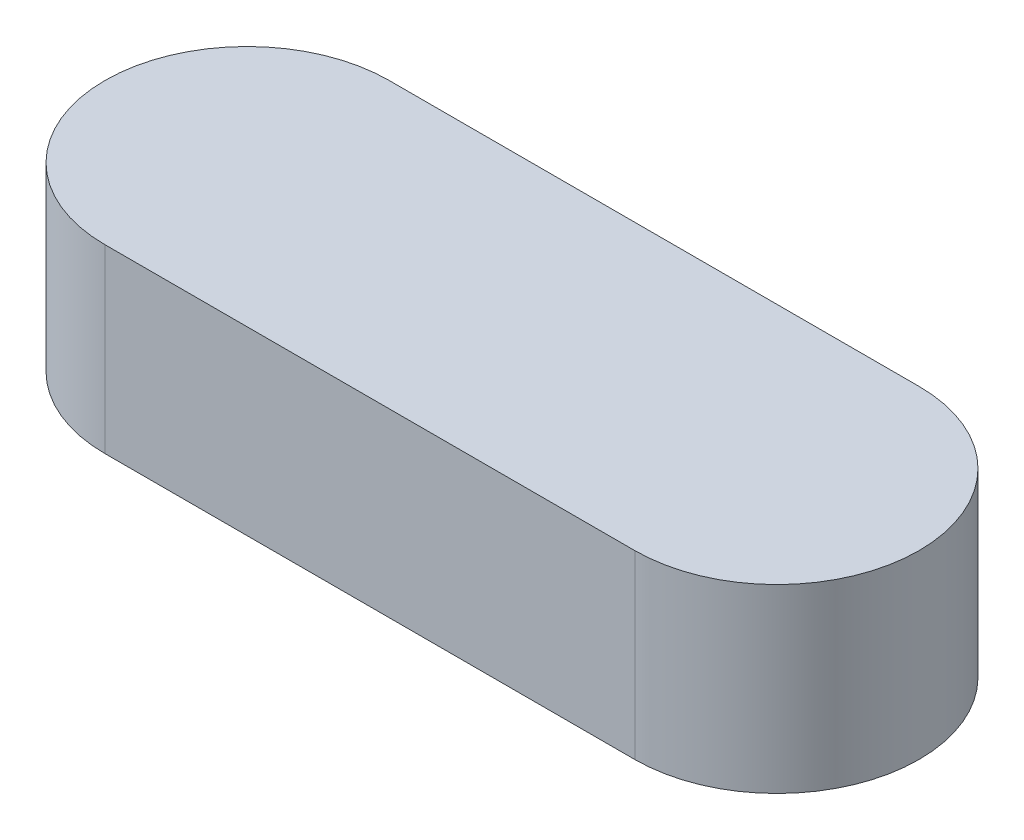
from build123d import *

# Parameters (mm, degrees)
BOSS_EXTRU_1_DEPTH = 14


with BuildPart() as part:
    # Esquisse1 → Boss.-Extru.1 (new body)
    with BuildSketch(Plane(origin=(0, 0, 0), x_dir=(1, 0, 0), z_dir=(0, 1, 0))):
        with BuildLine():
            Line((20.5, -11), (-20.5, -11))
            ThreePointArc((-20.5, -11), (-31.5, 0), (-20.5, 11))
            Line((-20.5, 11), (20.5, 11))
            ThreePointArc((20.5, 11), (31.5, 0), (20.5, -11))
        make_face()
    extrude(amount=BOSS_EXTRU_1_DEPTH)


solid = part.part
